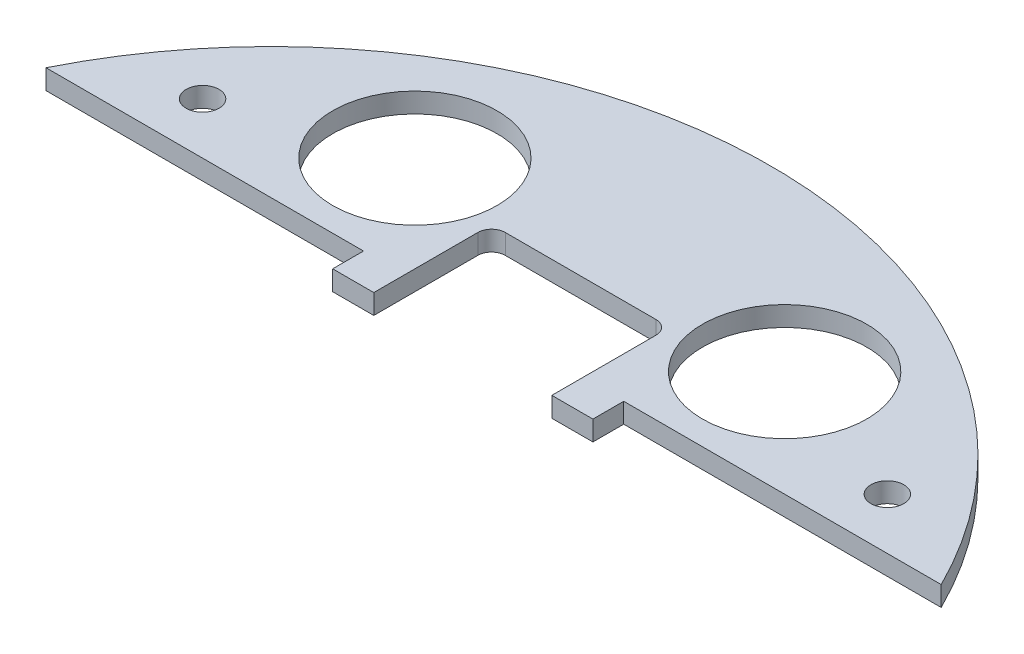
from build123d import *

# Parameters (mm, degrees)
BOSS_EXTRUDE1_DEPTH  = 2.9
SOLENOID_PLACEMENT_W = 38
SOLENOID_PLACEMENT_H = 64
CUT_EXTRUDE1_DEPTH   = 104.278313309
CUT_EXTRUDE4_DEPTH   = 104.278313309
SKETCH5_R            = 12
CUT_EXTRUDE5_DEPTH   = 104.278313309
SKETCH6_R            = 2.4
CUT_EXTRUDE6_DEPTH   = 104.278313309
CUT_EXTRUDE3_DEPTH   = 104.278313309


with BuildPart() as part:
    # Sketch1 → Boss-Extrude1 (new body)
    with BuildSketch(Plane(origin=(0, 0, 0), x_dir=(1, 0, 0), z_dir=(0, 1, 0))):
        with BuildLine():
            ThreePointArc((36.856602833, -63.012624351), (0, 73), (-36.856602833, -63.012624351))
            ThreePointArc((-36.856602833, -63.012624351), (-33.368752207, -63.602994345), (-30.363140064, -61.737536127))
            ThreePointArc((-30.363140064, -61.737536127), (0, -46.75), (30.363140064, -61.737536127))
            ThreePointArc((30.363140064, -61.737536127), (33.368752207, -63.602994345), (36.856602833, -63.012624351))
        make_face()
    extrude(amount=BOSS_EXTRUDE1_DEPTH)

    # solenoid placement → Cut-Extrude1 (cut, through all)
    with BuildSketch(Plane(origin=(0, 2.9, 0), x_dir=(1, 0, 0), z_dir=(0, 1, 0))):
        with Locations((0, -4)):
            Rectangle(SOLENOID_PLACEMENT_W, SOLENOID_PLACEMENT_H)
    extrude(amount=-CUT_EXTRUDE1_DEPTH, mode=Mode.SUBTRACT)

    # Sketch4 → Cut-Extrude4 (cut, through all)
    with BuildSketch(Plane(origin=(0, 2.9, 0), x_dir=(1, 0, 0), z_dir=(0, 1, 0))):
        with BuildLine():
            Line((-13, 28), (13, 28))
            Line((13, 28), (13, 43.2))
            ThreePointArc((13, 43.2), (12.414213562, 44.614213562), (11, 45.2))
            Line((11, 45.2), (-11, 45.2))
            ThreePointArc((-11, 45.2), (-12.414213562, 44.614213562), (-13, 43.2))
            Line((-13, 43.2), (-13, 28))
        make_face()
    extrude(amount=-CUT_EXTRUDE4_DEPTH, mode=Mode.SUBTRACT)

    # Sketch5 → Cut-Extrude5 (cut, through all)
    with BuildSketch(Plane(origin=(0, 2.9, 0), x_dir=(1, 0, 0), z_dir=(0, 1, 0))):
        with Locations(Location((-27, 48, 0), (0, 0, 270))):
            Circle(SKETCH5_R)
        with Locations(Location((27, 48, 0), (0, 0, 270))):
            Circle(SKETCH5_R)
    extrude(amount=-CUT_EXTRUDE5_DEPTH, mode=Mode.SUBTRACT)

    # Sketch6 → Cut-Extrude6 (cut, through all)
    with BuildSketch(Plane(origin=(0, 2.9, 0), x_dir=(1, 0, 0), z_dir=(0, 1, 0))):
        with Locations(Location((40, -40, 0), (0, 0, 270))):
            Circle(SKETCH6_R)
        with Locations(Location((-40, -40, 0), (0, 0, 270))):
            Circle(SKETCH6_R)
        with Locations(Location((-50, 40, 0), (0, 0, 270))):
            Circle(SKETCH6_R)
        with Locations(Location((50, 40, 0), (0, 0, 270))):
            Circle(SKETCH6_R)
    extrude(amount=-CUT_EXTRUDE6_DEPTH, mode=Mode.SUBTRACT)

    # Sketch3 → Cut-Extrude3 (cut, through all)
    with BuildSketch(Plane(origin=(0, 2.9, 0), x_dir=(1, 0, 0), z_dir=(0, 1, 0))):
        Polygon((-19, 28), (19, 28), (19, 32.5), (73, 32.5), (73, -32.5), (-73, -32.5), (-73, 32.5), (-19, 32.5), align=None)
    extrude(amount=-CUT_EXTRUDE3_DEPTH, mode=Mode.SUBTRACT)


with BuildPart() as cut_extrude3_piece_1:
    # of the separate pieces the step leaves, piece 1, a body of its own (cut_extrude3_pieces)
    add(part.part.solids().sort_by_distance((65.366275709, 0, -32.5))[0])


with BuildPart() as cut_extrude3_piece_2:
    # of the separate pieces the step leaves, piece 2, a body of its own (cut_extrude3_pieces)
    add(part.part.solids().sort_by_distance((-36.856602833, 0, 63.012624351))[0])


solid = cut_extrude3_piece_1.part
